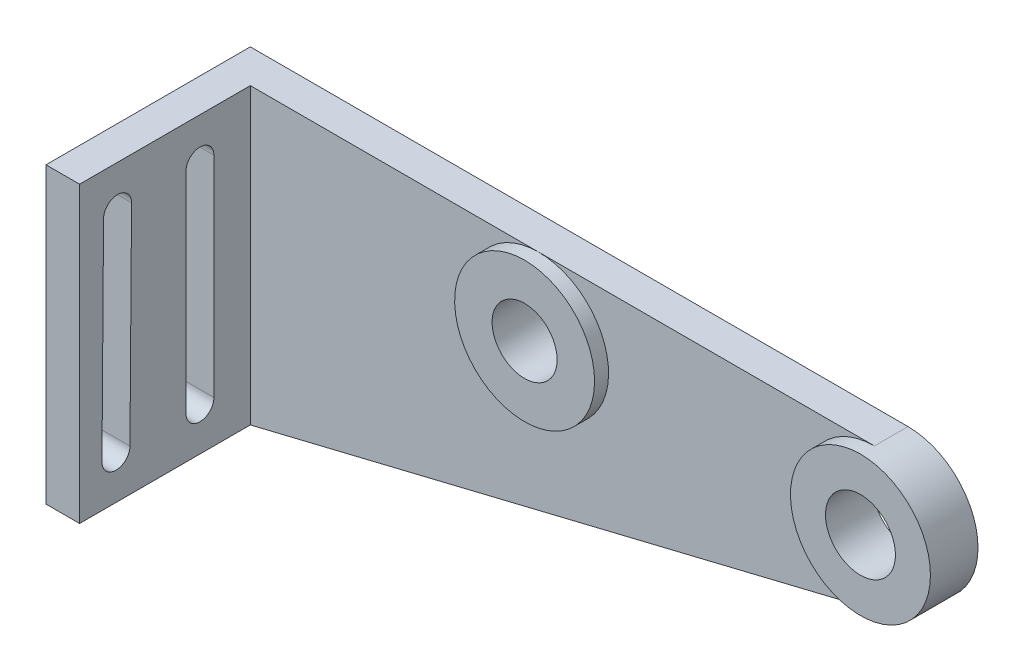
from build123d import *

# Parameters (mm, degrees)
SKETCH1_R            = 25
SKETCH1_R_2          = 11.619106241
SKETCH1_R_3          = 12.5
BOSS_EXTRUDE41_DEPTH = 12
SKETCH1_11_W         = 12
SKETCH1_11_H         = 105
BOSS_EXTRUDE42_DEPTH = 73
BOSS_EXTRUDE43_START = 12
SKETCH1_12_R         = 25
SKETCH1_12_R_2       = 11.619106241
SKETCH1_12_R_3       = 12.5
BOSS_EXTRUDE43_DEPTH = 5
CUT_EXTRUDE1_DEPTH   = 280.030464287


with BuildPart() as part:
    # Sketch1 → Boss-Extrude41 (new body)
    # profile 1 of 3: a face of its own
    with BuildSketch(Plane.XY):
        with BuildLine():
            Line((115, 0), (12, 0))
            Line((12, 0), (12, -105))
            Line((12, -105), (240.911574023, -49.291012588))
            ThreePointArc((240.911574023, -49.291012588), (210.177879676, -27.976968701), (235, 0))
            Line((235, 0), (115, 0))
        make_face()
        with BuildLine():
            ThreePointArc((140, -25), (97.32233047, -42.67766953), (115, 0))
            ThreePointArc((115, 0), (132.67766953, -7.32233047), (140, -25))
        make_face(mode=Mode.SUBTRACT)
    # profile 2 of 3: a face of its own
    with BuildSketch(Plane.XY):
        with Locations((115, -25)):
            Circle(SKETCH1_R)
        with Locations((115, -25)):
            Circle(SKETCH1_R_2, mode=Mode.SUBTRACT)
    # profile 3 of 3: a face of its own
    with BuildSketch(Plane.XY):
        with Locations((235, -25)):
            Circle(SKETCH1_R)
        with Locations((235, -25)):
            Circle(SKETCH1_R_3, mode=Mode.SUBTRACT)
    extrude(amount=BOSS_EXTRUDE41_DEPTH)

    # Sketch1<11> → Boss-Extrude42 (add)
    with BuildSketch(Plane.XY):
        with Locations((6, -52.5)):
            Rectangle(SKETCH1_11_W, SKETCH1_11_H)
    extrude(amount=BOSS_EXTRUDE42_DEPTH)

    # Sketch1<12> → Boss-Extrude43 (add)
    # profile 1 of 2: a face of its own
    with BuildSketch(Plane.XY.offset(BOSS_EXTRUDE43_START)):
        with Locations(Location((115, -25, 0), (0, 0, 90))):
            Circle(SKETCH1_12_R)
        with Locations((115, -25)):
            Circle(SKETCH1_12_R_2, mode=Mode.SUBTRACT)
    # profile 2 of 2: a face of its own
    with BuildSketch(Plane.XY.offset(BOSS_EXTRUDE43_START)):
        with Locations(Location((235, -25, 0), (0, 0, 90))):
            Circle(SKETCH1_12_R)
        with Locations((235, -25)):
            Circle(SKETCH1_12_R_3, mode=Mode.SUBTRACT)
    extrude(amount=BOSS_EXTRUDE43_DEPTH)

    # Sketch2 → Cut-Extrude1 (cut, through all)
    with BuildSketch(Plane(origin=(12, 0, 0), x_dir=(0, 0, -1), z_dir=(1, 0, 0))):
        with BuildLine():
            Line((-54.435034179, -15.03767278), (-55.000141926, -90.03767278))
            ThreePointArc((-55.000141926, -90.03767278), (-60.03767278, -94.999858074), (-64.999858074, -89.96232722))
            Line((-64.999858074, -89.96232722), (-64.434750327, -14.96232722))
            ThreePointArc((-64.434750327, -14.96232722), (-59.397219473, -10.000141926), (-54.435034179, -15.03767278))
        make_face()
        with BuildLine():
            Line((-25, -15), (-25, -90))
            ThreePointArc((-25, -90), (-30, -95), (-35, -90))
            Line((-35, -90), (-35, -15))
            ThreePointArc((-35, -15), (-30, -10), (-25, -15))
        make_face()
    extrude(amount=-CUT_EXTRUDE1_DEPTH, mode=Mode.SUBTRACT)


solid = part.part
